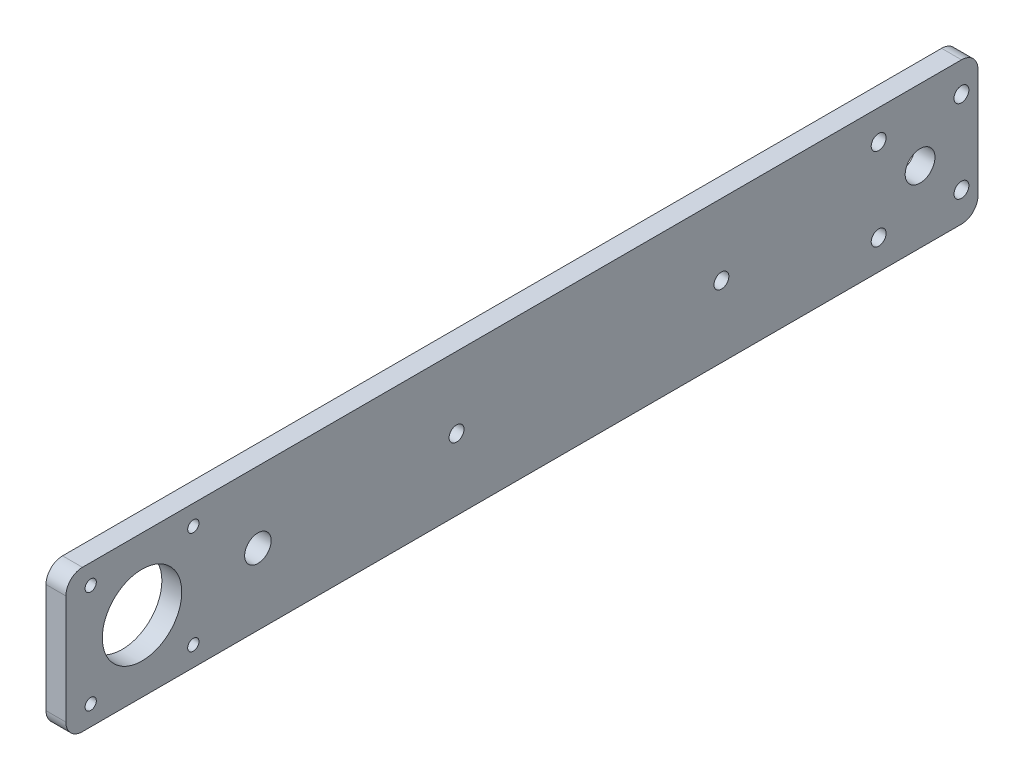
from build123d import *

# Parameters (mm, degrees)
CROQUIS2_W                   = 275.5
CROQUIS2_H                   = 43
CROQUIS2_R                   = 4
CROQUIS2_R_2                 = 4.5
CROQUIS2_R_3                 = 12
SALIENTE_EXTRUIR1_DEPTH      = 3
REDONDEO1_R                  = 5
TALADRO_DE_MARGEN_PARA_M41_D = 4.5
TALADRO_DE_MARGEN_PARA_M31_D = 3.4
TALADRO_DE_MARGEN_PARA_M42_D = 4.5


with BuildPart() as part:
    # Croquis2 → Saliente-Extruir1 (new, symmetric)
    with BuildSketch(Plane(origin=(0, 0, 0), x_dir=(0, 0, -1), z_dir=(1, 0, 0))):
        with Locations((-20.25, 0)):
            Rectangle(CROQUIS2_W, CROQUIS2_H)
        with Locations((-100, 0)):
            Circle(CROQUIS2_R, mode=Mode.SUBTRACT)
        with Locations((100, 0)):
            Circle(CROQUIS2_R_2, mode=Mode.SUBTRACT)
        with Locations((-135, 0)):
            Circle(CROQUIS2_R_3, mode=Mode.SUBTRACT)
    extrude(amount=SALIENTE_EXTRUIR1_DEPTH, both=True)

    # Redondeo1
    redondeo1_edges = [part.edges().sort_by_distance(p)[0] for p in [
        (0, 21.5, 158),
        (0, 21.5, -117.5),
        (0, -21.5, -117.5),
        (0, -21.5, 158),
    ]]
    fillet(redondeo1_edges, radius=REDONDEO1_R)

    # Taladro de margen para M41 (through all)
    with Locations(Plane(origin=(3, 0, 0), x_dir=(0, 0, -1), z_dir=(1, 0, 0))):
        with Locations((112.5, 12.5), (112.5, -12.5), (87.5, -12.5), (87.5, 12.5)):
            Hole(TALADRO_DE_MARGEN_PARA_M41_D / 2)

    # Taladro de margen para M31 (through all)
    with Locations(Plane.ZY.offset(3)):
        with Locations((150.5, 15.5), (119.5, 15.5), (119.5, -15.5), (150.5, -15.5)):
            Hole(TALADRO_DE_MARGEN_PARA_M31_D / 2)

    # Taladro de margen para M42 (through all)
    with Locations(Plane.ZY.offset(3)):
        with Locations((-40, 0), (40, 0)):
            Hole(TALADRO_DE_MARGEN_PARA_M42_D / 2)


solid = part.part
